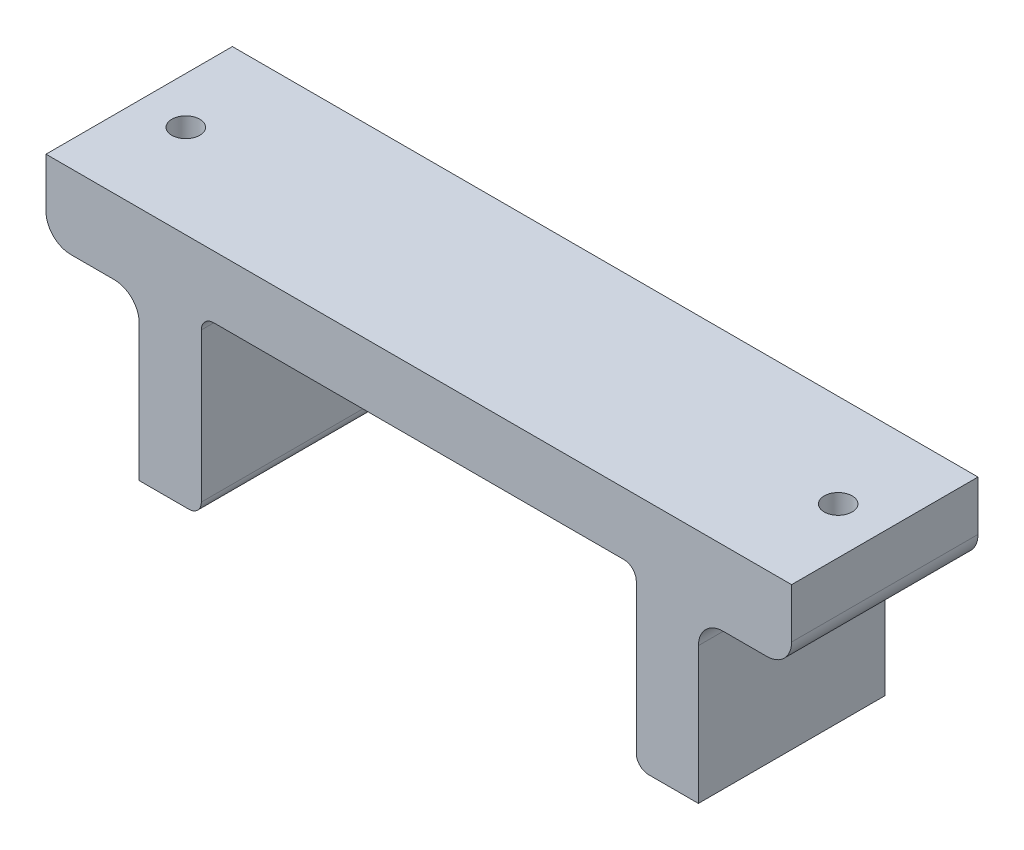
from build123d import *

# Parameters (mm, degrees)
BOSS_EXTRUDE1_DEPTH     = 30
CUT_EXTRUDE1_DEPTH      = 72.944422994
CUT_EXTRUDE1_DEPTH_BACK = 4
SKETCH2_R               = 5
SKETCH3_R               = 2.25
CUT_EXTRUDE2_DEPTH      = 74.484692406
CHAMFER1_SIZE           = 1.5
SKETCH4_R               = 1.355
CUT_EXTRUDE3_DEPTH      = 10


with BuildPart() as part:
    # Sketch1 → Boss-Extrude1 (new body)
    with BuildSketch(Plane.XY):
        with BuildLine():
            Line((-35, -12), (-35, 12))
            ThreePointArc((-35, 12), (-34.414213562, 13.414213562), (-33, 14))
            Line((-33, 14), (33, 14))
            ThreePointArc((33, 14), (34.414213562, 13.414213562), (35, 12))
            Line((35, 12), (35, -12))
            ThreePointArc((35, -12), (35.585786438, -13.414213562), (37, -14))
            Line((37, -14), (45, -14))
            Line((45, -14), (45, 8))
            ThreePointArc((45, 8), (46.171572875, 10.828427125), (49, 12))
            Line((49, 12), (56, 12))
            ThreePointArc((56, 12), (58.828427125, 13.171572875), (60, 16))
            Line((60, 16), (60, 24))
            Line((60, 24), (33, 24))
            Line((33, 24), (-33, 24))
            Line((-33, 24), (-60, 24))
            Line((-60, 24), (-60, 16))
            ThreePointArc((-60, 16), (-58.828427125, 13.171572875), (-56, 12))
            Line((-56, 12), (-49, 12))
            ThreePointArc((-49, 12), (-46.171572875, 10.828427125), (-45, 8))
            Line((-45, 8), (-45, -14))
            Line((-45, -14), (-37, -14))
            ThreePointArc((-37, -14), (-35.585786438, -13.414213562), (-35, -12))
        make_face()
    extrude(amount=BOSS_EXTRUDE1_DEPTH)

    # Sketch2 → Cut-Extrude1 (cut, two sides: drawn at the far end of the back side and taken through both)
    with BuildSketch(Plane.XZ.offset(-12).offset(-CUT_EXTRUDE1_DEPTH_BACK)):
        with Locations(Location((-52.5, 15, 0), (0, 0, 134.427004004))):
            Circle(SKETCH2_R)
        with Locations(Location((52.5, 15, 0), (0, 0, 225.572995999))):
            Circle(SKETCH2_R)
    extrude(amount=CUT_EXTRUDE1_DEPTH + CUT_EXTRUDE1_DEPTH_BACK, mode=Mode.SUBTRACT)

    # Sketch3 → Cut-Extrude2 (cut, through all)
    with BuildSketch(Plane.XZ.offset(-16)):
        with Locations((-52.5, 15)):
            Circle(SKETCH3_R)
        with Locations((52.5, 15)):
            Circle(SKETCH3_R)
    extrude(amount=-CUT_EXTRUDE2_DEPTH, mode=Mode.SUBTRACT)

    # Chamfer1
    chamfer1_edges = [part.edges().sort_by_distance(p)[0] for p in [
        (-54.75, 16, 15),
        (50.25, 16, 15),
    ]]
    chamfer(chamfer1_edges, length=CHAMFER1_SIZE)

    # Sketch4 → Cut-Extrude3 (cut)
    with BuildSketch(Plane.XZ.offset(14)):
        with Locations(Location((-40, 15, 0), (0, 0, 270))):
            Circle(SKETCH4_R)
        with Locations(Location((40, 15, 0), (0, 0, 270))):
            Circle(SKETCH4_R)
    extrude(amount=-CUT_EXTRUDE3_DEPTH, mode=Mode.SUBTRACT)


solid = part.part
